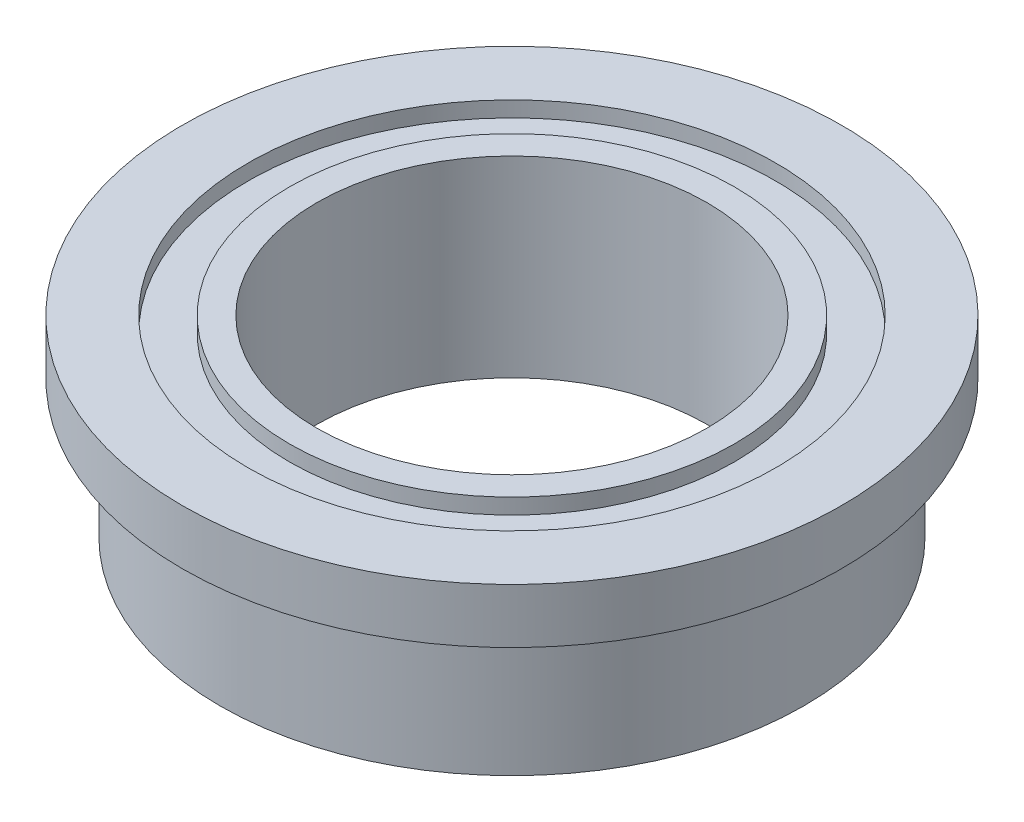
from build123d import *


with BuildPart() as part:
    # Sketch1 → Revolve1 (revolve)
    with BuildSketch(Plane(origin=(0, 0, 0), x_dir=(-1, 0, 0), z_dir=(0, 0, -1)), mode=Mode.PRIVATE) as revolve1_sk:
        Polygon((-3.175, 3.1242), (-3.6195, 3.1242), (-3.6195, 2.8702), (-4.2926, 2.8702), (-4.2926, 3.1242), (-5.3594, 3.1242), (-5.3594, 2.2352), (-4.7498, 2.2352), (-4.7498, 0), (-4.2926, 0), (-4.2926, 0.254), (-3.6195, 0.254), (-3.6195, 0), (-3.175, 0), align=None)
    revolve(revolve1_sk.sketch.rotate(Axis((0, 0, 0), (0, 1, 0)), 270), axis=Axis((0, 0, 0), (0, 1, 0)))


solid = part.part
